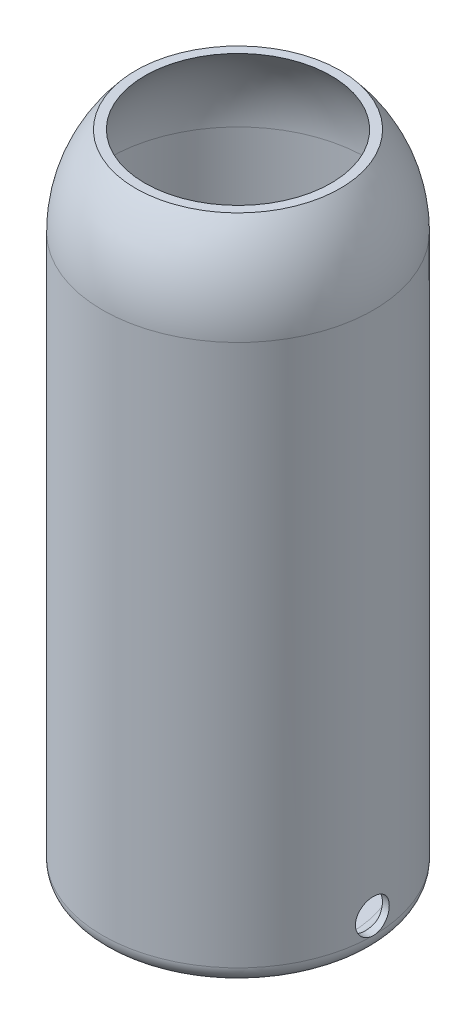
from build123d import *

# Parameters (mm, degrees)
SKETCH5_R          = 5
CUT_EXTRUDE1_DEPTH = 50
SKETCH5_3_R        = 2.5
CUT_EXTRUDE2_DEPTH = 50


with BuildPart() as part:
    # Sketch3 → Revolve4 (revolve)
    with BuildSketch(Plane(origin=(0, 0, 0), x_dir=(0, 0, -1), z_dir=(1, 0, 0))):
        with BuildLine():
            Line((40, 2), (40, 0))
            Line((40, 0), (75, 0))
            ThreePointArc((75, 0), (78.535533906, 1.464466094), (80, 5))
            Line((80, 5), (80, 165))
            ThreePointArc((80, 165), (77.47091582, 178.997516479), (70.203476621, 191.224988084))
            Line((70.203476621, 191.224988084), (67.5, 191.224988084))
            ThreePointArc((67.5, 191.224988084), (75.277471565, 179.124446892), (78, 165))
            Line((78, 165), (78, 7))
            ThreePointArc((78, 7), (76.535533906, 3.464466094), (73, 2))
            Line((73, 2), (42, 2))
            Line((42, 2), (40, 2))
        make_face()
    revolve(axis=Axis((0, 250.694261232, -40), (0, -1, 0)))

    # Sketch5 → Cut-Extrude1 (cut)
    with BuildSketch(Plane(origin=(0, 0, 0), x_dir=(0, 0, -1), z_dir=(1, 0, 0))):
        with Locations((40, 10)):
            Circle(SKETCH5_R)
    extrude(amount=CUT_EXTRUDE1_DEPTH, mode=Mode.SUBTRACT)

    # Sketch5<3> → Cut-Extrude2 (cut)
    with BuildSketch(Plane(origin=(0, 0, 0), x_dir=(0, 0, -1), z_dir=(1, 0, 0))):
        with Locations((40, 10)):
            Circle(SKETCH5_3_R)
    extrude(amount=-CUT_EXTRUDE2_DEPTH, mode=Mode.SUBTRACT)


solid = part.part
